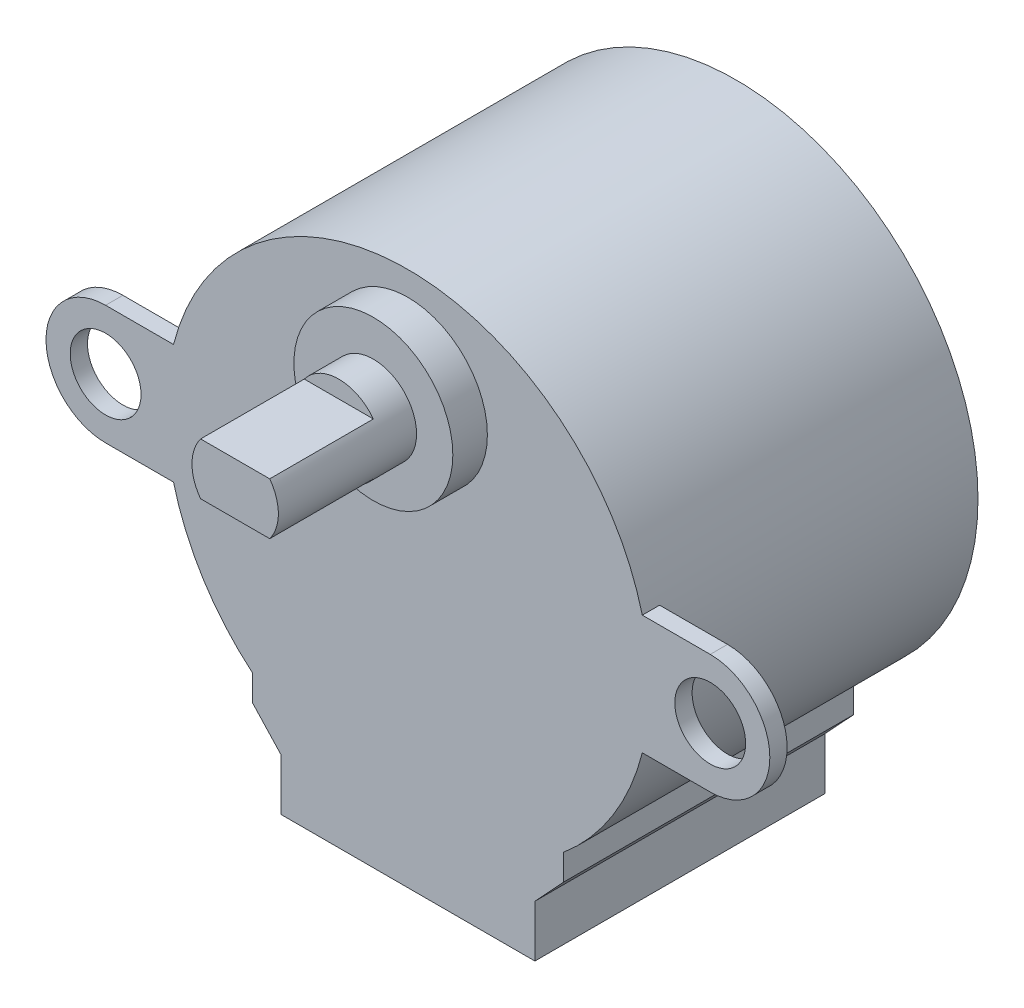
from build123d import *

# Parameters (mm, degrees)
SKETCH1_R           = 14
BOSS_EXTRUDE1_DEPTH = 19
BOSS_EXTRUDE2_START = -16.8
BOSS_EXTRUDE2_DEPTH = 16.8
CUT_EXTRUDE1_DEPTH  = 2
BOSS_EXTRUDE3_START = -1
SKETCH5_R           = 2.05
BOSS_EXTRUDE3_DEPTH = 1
SKETCH6_R           = 4.6
BOSS_EXTRUDE4_DEPTH = 2
SKETCH7_R           = 2.5
BOSS_EXTRUDE5_DEPTH = 8
CUT_EXTRUDE2_START  = -6
CUT_EXTRUDE2_DEPTH  = 6


with BuildPart() as part:
    # Sketch1 → Boss-Extrude1 (new body)
    with BuildSketch(Plane.XY):
        Circle(SKETCH1_R)
    extrude(amount=BOSS_EXTRUDE1_DEPTH)

    # Sketch2 → Boss-Extrude2 (add)
    with BuildSketch(Plane.XY.offset(19).offset(BOSS_EXTRUDE2_START)):
        with BuildLine():
            Line((-7.35, -17), (7.35, -17))
            Line((7.35, -17), (7.35, -14))
            Line((7.35, -14), (9, -12.223805295))
            Line((9, -12.223805295), (9, -10.723805295))
            ThreePointArc((9, -10.723805295), (0, -14), (-9, -10.723805295))
            Line((-9, -10.723805295), (-9, -12.223805295))
            Line((-9, -12.223805295), (-7.35, -14))
            Line((-7.35, -14), (-7.35, -17))
        make_face()
    extrude(amount=BOSS_EXTRUDE2_DEPTH)

    # Sketch4 → Cut-Extrude1 (cut)
    with BuildSketch(Plane.XZ.offset(17)):
        with BuildLine():
            Line((-3, 17.75), (3, 17.75))
            ThreePointArc((3, 17.75), (3.5, 17.25), (3, 16.75))
            Line((3, 16.75), (-3, 16.75))
            ThreePointArc((-3, 16.75), (-3.5, 17.25), (-3, 17.75))
        make_face()
    extrude(amount=-CUT_EXTRUDE1_DEPTH, mode=Mode.SUBTRACT)

    # Sketch5 → Boss-Extrude3 (add)
    # profile 1 of 2: a face of its own
    with BuildSketch(Plane.XY.offset(19).offset(BOSS_EXTRUDE3_START)):
        with BuildLine():
            Line((-17.5, 3.45), (-13.568253388, 3.45))
            ThreePointArc((-13.568253388, 3.45), (-14, 0), (-13.568253388, -3.45))
            Line((-13.568253388, -3.45), (-17.5, -3.45))
            ThreePointArc((-17.5, -3.45), (-20.95, 0), (-17.5, 3.45))
        make_face()
        with Locations((-17.5, 0)):
            Circle(SKETCH5_R, mode=Mode.SUBTRACT)
    # profile 2 of 2: a face of its own
    with BuildSketch(Plane.XY.offset(19).offset(BOSS_EXTRUDE3_START)):
        with BuildLine():
            Line((17.5, -3.45), (13.568253388, -3.45))
            ThreePointArc((13.568253388, -3.45), (14, 0), (13.568253388, 3.45))
            Line((13.568253388, 3.45), (17.5, 3.45))
            ThreePointArc((17.5, 3.45), (20.95, 0), (17.5, -3.45))
        make_face()
        with Locations(Location((17.5, 0, 0), (0, 0, 180))):
            Circle(SKETCH5_R, mode=Mode.SUBTRACT)
    extrude(amount=BOSS_EXTRUDE3_DEPTH)

    # Sketch6 → Boss-Extrude4 (add)
    with BuildSketch(Plane.XY.offset(19)):
        with Locations((0, 8)):
            Circle(SKETCH6_R)
    extrude(amount=BOSS_EXTRUDE4_DEPTH)

    # Sketch7 → Boss-Extrude5 (add)
    with BuildSketch(Plane.XY.offset(21)):
        with Locations((0, 8)):
            Circle(SKETCH7_R)
    extrude(amount=BOSS_EXTRUDE5_DEPTH)

    # Sketch8 → Cut-Extrude2 (cut)
    with BuildSketch(Plane.XY.offset(29).offset(CUT_EXTRUDE2_START)):
        with BuildLine():
            ThreePointArc((2, 9.5), (0, 10.5), (-2, 9.5))
            Line((-2, 9.5), (2, 9.5))
        make_face()
        with BuildLine():
            Line((2, 6.5), (-2, 6.5))
            ThreePointArc((-2, 6.5), (0, 5.5), (2, 6.5))
        make_face()
    extrude(amount=CUT_EXTRUDE2_DEPTH, mode=Mode.SUBTRACT)


solid = part.part
